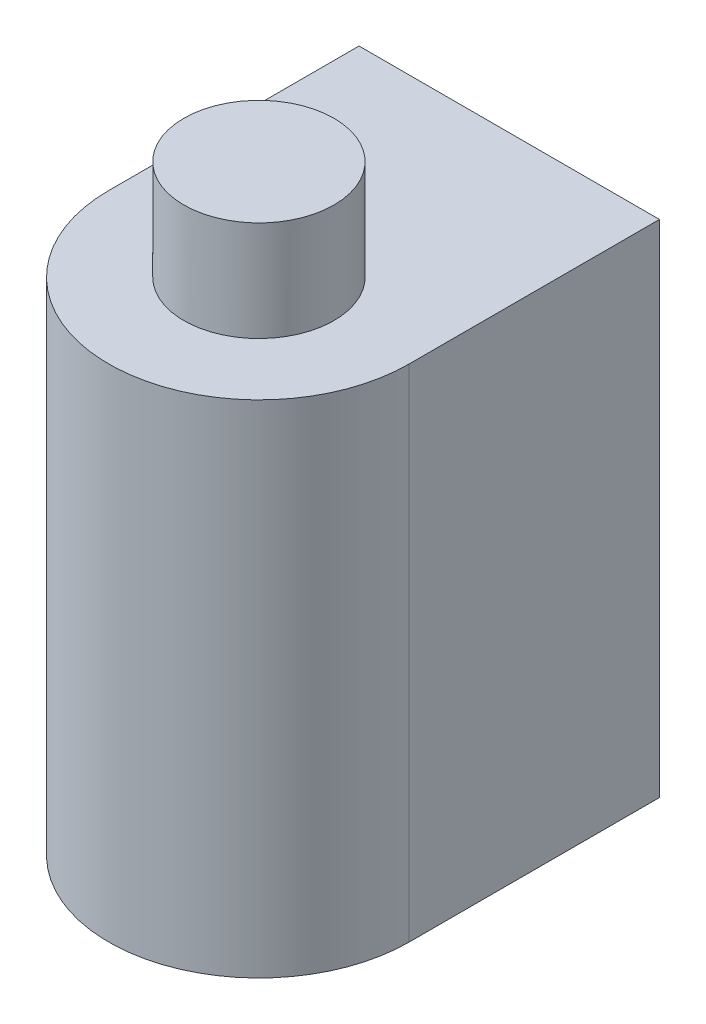
from build123d import *

# Parameters (mm, degrees)
SKETCH1_W           = 6
SKETCH1_H           = 10
BOSS_EXTRUDE1_DEPTH = 8
FILLET2_RADIUS      = 3
FILLET2_LENGTH      = 10
SKETCH2_R           = 1.5
BOSS_EXTRUDE2_DEPTH = 2


with BuildPart() as part:
    # Sketch1 → Boss-Extrude1 (new body)
    with BuildSketch(Plane.XY):
        Rectangle(SKETCH1_W, SKETCH1_H)
    extrude(amount=BOSS_EXTRUDE1_DEPTH)

    # Fillet2: full round fillet: the end face becomes a half cylinder, R = half its width
    fillet2_face = Plane((0, 0, 8), x_dir=(0, -1, 0), z_dir=(0, 0, 1))  # on the end face: x along it, z out of the body
    fillet2_slab = fillet2_face.offset(-FILLET2_RADIUS / 2) * Box(FILLET2_LENGTH, 2 * FILLET2_RADIUS, FILLET2_RADIUS, mode=Mode.PRIVATE)  # the body's end, R deep
    fillet2_round = Plane((0, 0, 5), x_dir=(0, 0, 1), z_dir=(0, -1, 0)) * Cylinder(FILLET2_RADIUS, FILLET2_LENGTH, mode=Mode.PRIVATE)  # its axis R under the face
    add(fillet2_slab - fillet2_round, mode=Mode.SUBTRACT)

    # Sketch2 → Boss-Extrude2 (add)
    with BuildSketch(Plane(origin=(0, 5, 0), x_dir=(1, 0, 0), z_dir=(0, 1, 0))):
        with Locations(Location((0, -5, 0), (0, 0, 90))):
            Circle(SKETCH2_R)
    extrude(amount=BOSS_EXTRUDE2_DEPTH)


solid = part.part
